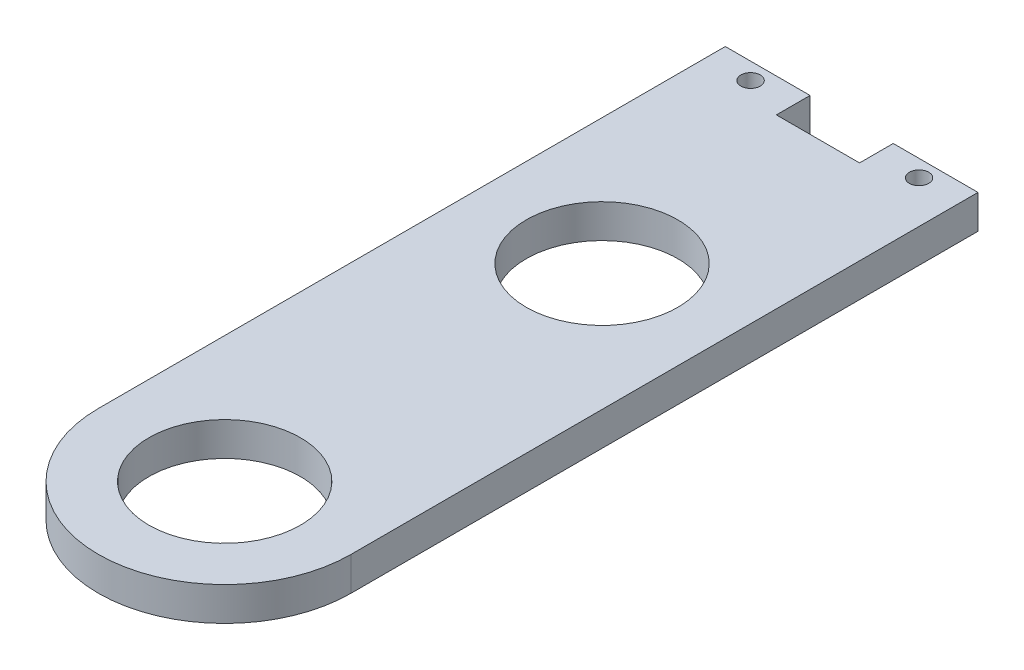
from build123d import *

# Parameters (mm, degrees)
SKETCH1_W           = 47.625
SKETCH1_H           = 152.4
SKETCH1_R           = 14.2875
BOSS_EXTRUDE1_DEPTH = 6.35
CUT_EXTRUDE1_DEPTH  = 81.086188923
SKETCH3_W           = 15.975
SKETCH3_H           = 6.35
BOSS_EXTRUDE2_DEPTH = 6.35
SKETCH4_R           = 1.8288
CUT_EXTRUDE2_DEPTH  = 87.15021855


with BuildPart() as part:
    # Sketch1 → Boss-Extrude1 (new body)
    with BuildSketch(Plane(origin=(0, 0, 0), x_dir=(1, 0, 0), z_dir=(0, 1, 0))):
        Rectangle(SKETCH1_W, SKETCH1_H)
        with Locations(Location((0, 35.5092, 0), (0, 0, 270))):
            Circle(SKETCH1_R, mode=Mode.SUBTRACT)
        with Locations(Location((0, -35.6108, 0), (0, 0, 270))):
            Circle(SKETCH1_R, mode=Mode.SUBTRACT)
    extrude(amount=BOSS_EXTRUDE1_DEPTH)

    # Sketch2 → Cut-Extrude1 (cut, through all)
    with BuildSketch(Plane(origin=(0, 6.35, 0), x_dir=(1, 0, 0), z_dir=(0, 1, 0))):
        with BuildLine():
            ThreePointArc((23.8125, -35.6108), (0, -59.4233), (-23.8125, -35.6108))
            Line((-23.8125, -35.6108), (-23.8125, -76.2))
            Line((-23.8125, -76.2), (23.8125, -76.2))
            Line((23.8125, -76.2), (23.8125, -35.6108))
        make_face()
    extrude(amount=-CUT_EXTRUDE1_DEPTH, mode=Mode.SUBTRACT)

    # Sketch3 → Boss-Extrude2 (add)
    with BuildSketch(Plane(origin=(0, 6.35, 0), x_dir=(1, 0, 0), z_dir=(0, 1, 0))):
        with Locations((-15.825, 79.375)):
            Rectangle(SKETCH3_W, SKETCH3_H)
        with Locations((15.825, 79.375)):
            Rectangle(SKETCH3_W, SKETCH3_H)
    extrude(amount=-BOSS_EXTRUDE2_DEPTH)

    # Sketch4 → Cut-Extrude2 (cut, through all)
    with BuildSketch(Plane(origin=(0, 6.35, 0), x_dir=(1, 0, 0), z_dir=(0, 1, 0))):
        with Locations(Location((-15.875, 79.375, 0), (0, 0, 270))):
            Circle(SKETCH4_R)
        with Locations(Location((15.875, 79.375, 0), (0, 0, 270))):
            Circle(SKETCH4_R)
    extrude(amount=-CUT_EXTRUDE2_DEPTH, mode=Mode.SUBTRACT)


solid = part.part
